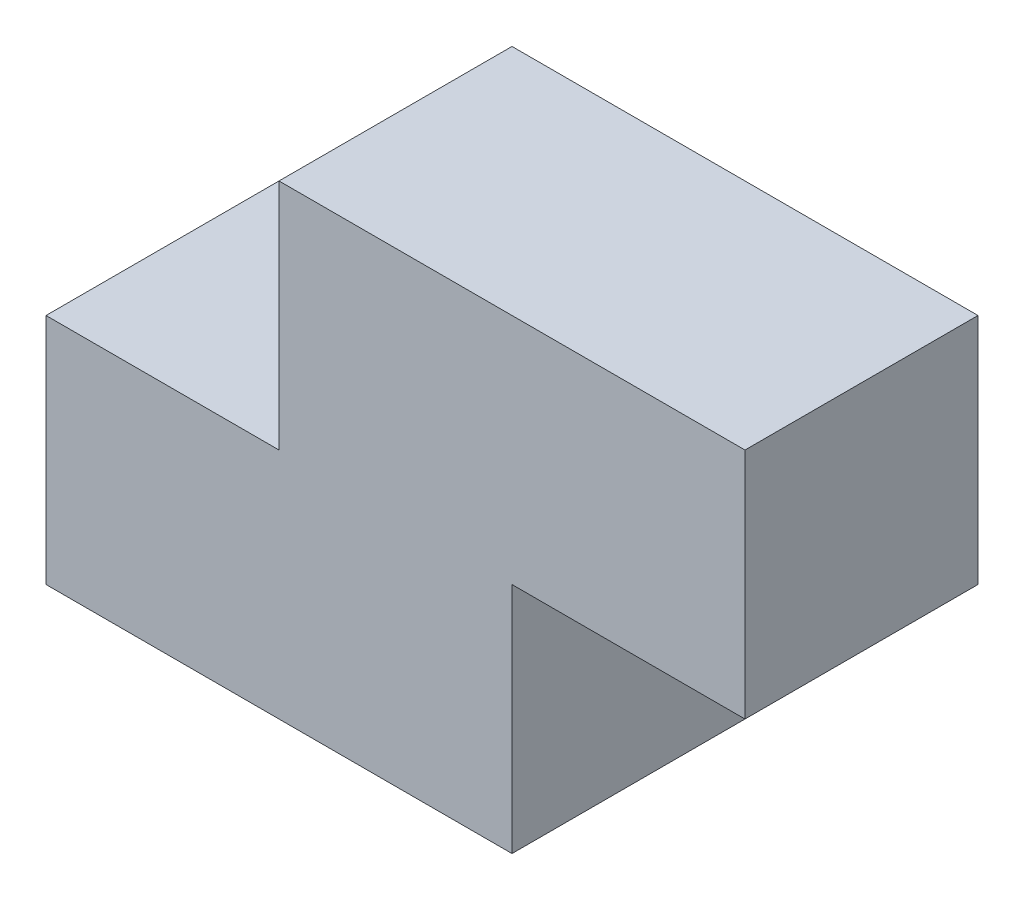
from build123d import *

# Parameters (mm, degrees)
EXTRUDE_1_DEPTH      = 15
EXTRUDE_1_DEPTH_BACK = 15


with BuildPart() as part:
    # 草圖1 → 擠出1 (new, two sides: drawn at the far end of the back side and taken through both)
    with BuildSketch(Plane.XY.offset(-EXTRUDE_1_DEPTH_BACK)):
        Polygon((0, 0), (60, 0), (60, 30), (90, 30), (90, 60), (30, 60), (30, 30), (0, 30), align=None)
    extrude(amount=EXTRUDE_1_DEPTH + EXTRUDE_1_DEPTH_BACK)


solid = part.part
